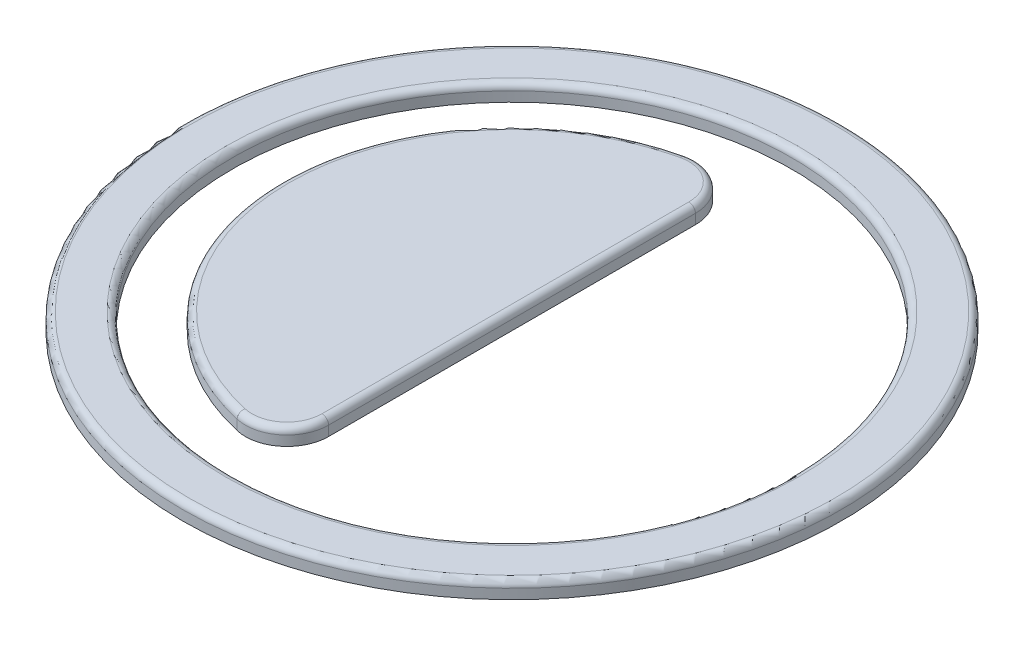
from build123d import *

# Parameters (mm, degrees)
EXTRUDE_1_DEPTH   = 0.5
SKETCH_1_R        = 10
SKETCH_1_R_2      = 8.490267481
EXTRUDE_1_2_DEPTH = 0.5
FILLET_1_R        = 0.2
FILLET_2_R        = 0.2
FILLET_3_R        = 0.2


with BuildPart() as part:
    # Эскиз1 → Бобышка-Вытянуть1 (new body)
    with BuildSketch(Plane(origin=(0, 0, 0), x_dir=(1, 0, 0), z_dir=(0, 1, 0))):
        with BuildLine():
            ThreePointArc((0, -5.565646409), (-0.474742908, -6.552289655), (-1.5419684, -6.796984316))
            ThreePointArc((-1.5419684, -6.796984316), (-6.969696, 0), (-1.5419684, 6.796984316))
            ThreePointArc((-1.5419684, 6.796984316), (-0.474742908, 6.552289655), (0, 5.565646409))
            Line((0, 5.565646409), (0, -5.565646409))
        make_face()
    extrude(amount=EXTRUDE_1_DEPTH)

    # Скругление1
    fillet_1_edges = [part.edges().sort_by_distance(p)[0] for p in [
        (-0.474742908, 0.5, -6.552289655),
        (-6.969696, 0.5, 0),
        (-0.474742908, 0.5, 6.552289655),
        (0, 0.5, 0),
    ]]
    fillet(fillet_1_edges, radius=FILLET_1_R)


with BuildPart() as body_2:
    # Эскиз1 → Extrude 1 2 (new body)
    with BuildSketch(Plane(origin=(0, 0, 0), x_dir=(1, 0, 0), z_dir=(0, 1, 0))):
        with Locations(Location((0, 0, 0), (0, 0, 270))):
            Circle(SKETCH_1_R)
        with Locations(Location((0, 0, 0), (0, 0, 270))):
            Circle(SKETCH_1_R_2, mode=Mode.SUBTRACT)
    extrude(amount=EXTRUDE_1_2_DEPTH)

    # Скругление2
    fillet_2_edges = [body_2.edges().sort_by_distance(p)[0] for p in [
        (0, 0.5, -8.490267481),
    ]]
    fillet(fillet_2_edges, radius=FILLET_2_R)

    # Скругление3
    fillet_3_edges = [body_2.edges().sort_by_distance(p)[0] for p in [
        (0, 0.5, -10),
    ]]
    fillet(fillet_3_edges, radius=FILLET_3_R)


solid = Compound([part.part, body_2.part])
